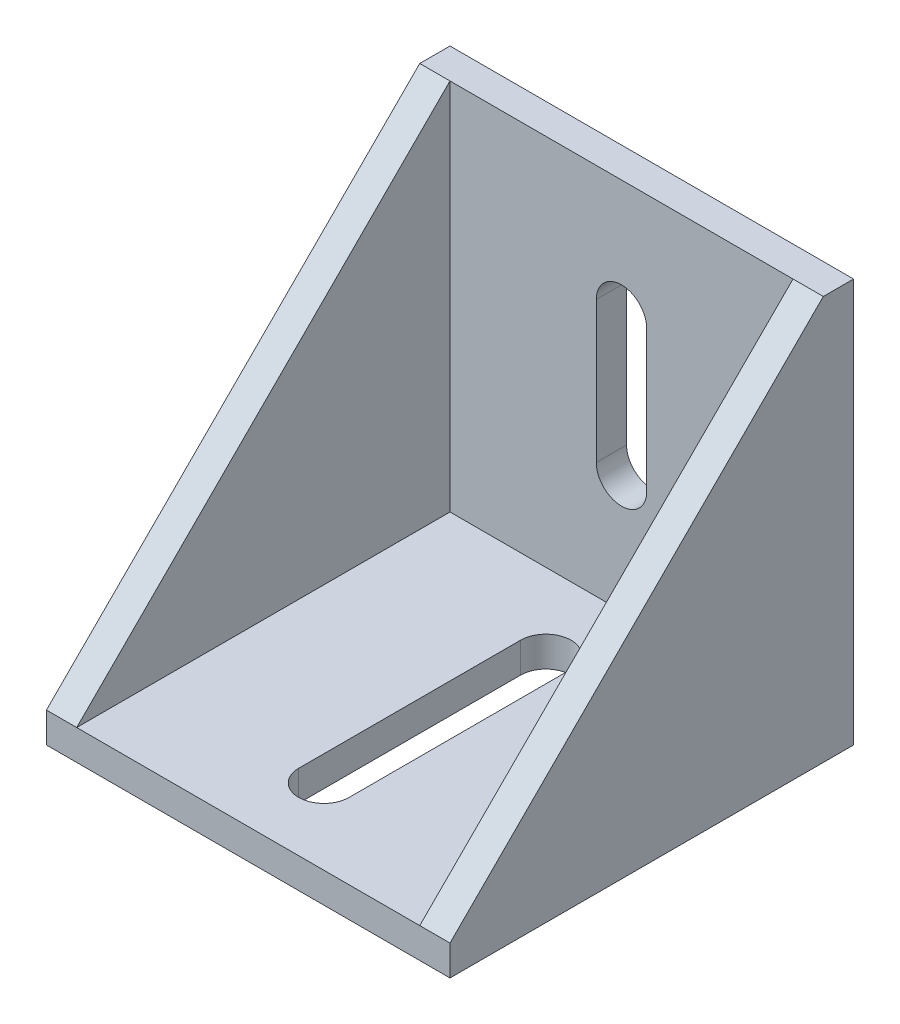
from build123d import *

# Parameters (mm, degrees)
SKETCH1_W           = 40
SKETCH1_H           = 40
BOSS_EXTRUDE1_DEPTH = 3
SKETCH2_W           = 40
SKETCH2_H           = 37
BOSS_EXTRUDE2_DEPTH = 3
BOSS_EXTRUDE3_DEPTH = 3
BOSS_EXTRUDE4_DEPTH = 3
CUT_EXTRUDE1_DEPTH  = 3
CUT_EXTRUDE2_DEPTH  = 3


with BuildPart() as part:
    # Sketch1 → Boss-Extrude1 (new body)
    with BuildSketch(Plane(origin=(0, 0, 0), x_dir=(1, 0, 0), z_dir=(0, 1, 0))):
        with Locations((20, -20)):
            Rectangle(SKETCH1_W, SKETCH1_H)
    extrude(amount=BOSS_EXTRUDE1_DEPTH)

    # Sketch2 → Boss-Extrude2 (add)
    with BuildSketch(Plane(origin=(0, 0, 0), x_dir=(-1, 0, 0), z_dir=(0, 0, -1))):
        with Locations((-20, 21.5)):
            Rectangle(SKETCH2_W, SKETCH2_H)
    extrude(amount=-BOSS_EXTRUDE2_DEPTH)

    # Sketch3 → Boss-Extrude3 (add)
    with BuildSketch(Plane.ZY):
        Polygon((3, 40), (3, 3), (40, 3), align=None)
    extrude(amount=-BOSS_EXTRUDE3_DEPTH)

    # Sketch4 → Boss-Extrude4 (add)
    with BuildSketch(Plane(origin=(40, 0, 0), x_dir=(0, 0, -1), z_dir=(1, 0, 0))):
        Polygon((-40, 3), (-3, 3), (-3, 40), align=None)
    extrude(amount=-BOSS_EXTRUDE4_DEPTH)

    # Sketch5 → Cut-Extrude1 (cut)
    with BuildSketch(Plane.XY.offset(3)):
        with BuildLine():
            Line((17.5, 14.5), (17.5, 28.5))
            ThreePointArc((17.5, 28.5), (20, 31), (22.5, 28.5))
            Line((22.5, 28.5), (22.5, 14.5))
            ThreePointArc((22.5, 14.5), (20, 12), (17.5, 14.5))
        make_face()
    extrude(amount=-CUT_EXTRUDE1_DEPTH, mode=Mode.SUBTRACT)

    # Sketch6 → Cut-Extrude2 (cut)
    with BuildSketch(Plane(origin=(0, 3, 0), x_dir=(1, 0, 0), z_dir=(0, 1, 0))):
        with BuildLine():
            Line((17.5, -32.5), (17.5, -10.5))
            ThreePointArc((17.5, -10.5), (20, -8), (22.5, -10.5))
            Line((22.5, -10.5), (22.5, -32.5))
            ThreePointArc((22.5, -32.5), (20, -35), (17.5, -32.5))
        make_face()
    extrude(amount=-CUT_EXTRUDE2_DEPTH, mode=Mode.SUBTRACT)


solid = part.part
